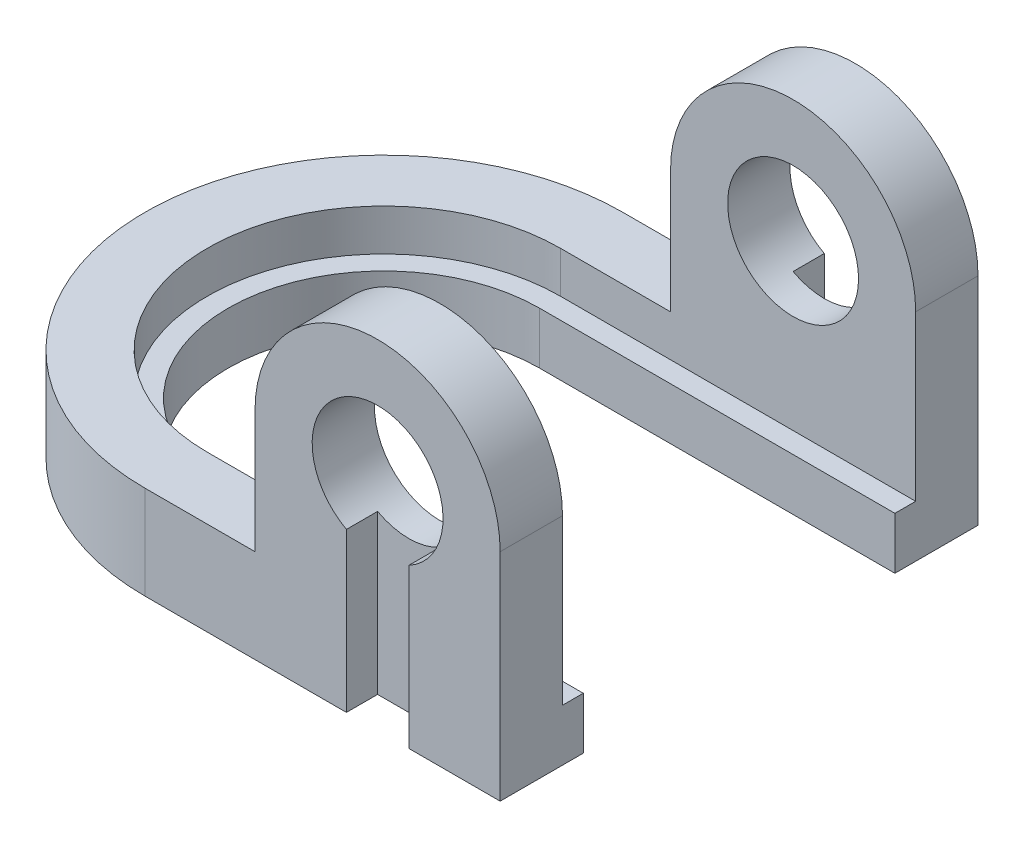
from build123d import *

# Parameters (mm, degrees)
EXTRUDE_2_DEPTH     = 25
EXTRUDE_3_DEPTH     = 45
SKETCH_2_R          = 31.5
EXTRUDE_4_DEPTH     = 30
SKETCH_3_W          = 30
SKETCH_3_H          = 172.84779514
CUT_EXTRUDE_1_DEPTH = 15


with BuildPart() as part:
    # 草图1 → 凸台-拉伸2 (new body)
    with BuildSketch(Plane(origin=(0, 0, 0), x_dir=(1, 0, 0), z_dir=(0, 1, 0))):
        with BuildLine():
            Line((171, -115), (171, -75))
            Line((171, -75), (0, -75))
            ThreePointArc((0, -75), (-75, 0), (0, 75))
            Line((0, 75), (171, 75))
            Line((171, 75), (171, 115))
            Line((171, 115), (0, 115))
            ThreePointArc((0, 115), (-115, 0), (0, -115))
            Line((0, -115), (171, -115))
        make_face()
    extrude(amount=EXTRUDE_2_DEPTH)

    # 草图1<5> → 凸台-拉伸3 (add)
    with BuildSketch(Plane(origin=(0, 0, 0), x_dir=(1, 0, 0), z_dir=(0, 1, 0))):
        with BuildLine():
            ThreePointArc((0, -85), (-85, 0), (0, 85))
            Line((0, 85), (171, 85))
            Line((171, 85), (171, 115))
            Line((171, 115), (0, 115))
            ThreePointArc((0, 115), (-115, 0), (0, -115))
            Line((0, -115), (171, -115))
            Line((171, -115), (171, -85))
            Line((171, -85), (0, -85))
        make_face()
    extrude(amount=EXTRUDE_3_DEPTH)

    # 草图2 → 凸台-拉伸4 (add)
    with BuildSketch(Plane.XY.offset(-85)):
        with BuildLine():
            Line((171, 25), (53, 25))
            Line((53, 25), (53, 104))
            ThreePointArc((53, 104), (112, 163), (171, 104))
            Line((171, 104), (171, 25))
        make_face()
        with Locations((112, 104)):
            Circle(SKETCH_2_R, mode=Mode.SUBTRACT)
    extrude_4 = extrude(amount=-EXTRUDE_4_DEPTH)

    # 草图3 → 切除-拉伸1 (cut)
    with BuildSketch(Plane(origin=(0, 0, -115), x_dir=(-1, 0, 0), z_dir=(0, 0, -1))):
        with Locations((-112, 0)):
            Rectangle(SKETCH_3_W, SKETCH_3_H)
    cut_extrude_1 = extrude(amount=-CUT_EXTRUDE_1_DEPTH, mode=Mode.SUBTRACT)

    # 镜向4: 凸台-拉伸4, 切除-拉伸1 across plane
    add(extrude_4.mirror(Plane.XY))
    add(cut_extrude_1.mirror(Plane.XY), mode=Mode.SUBTRACT)


solid = part.part
